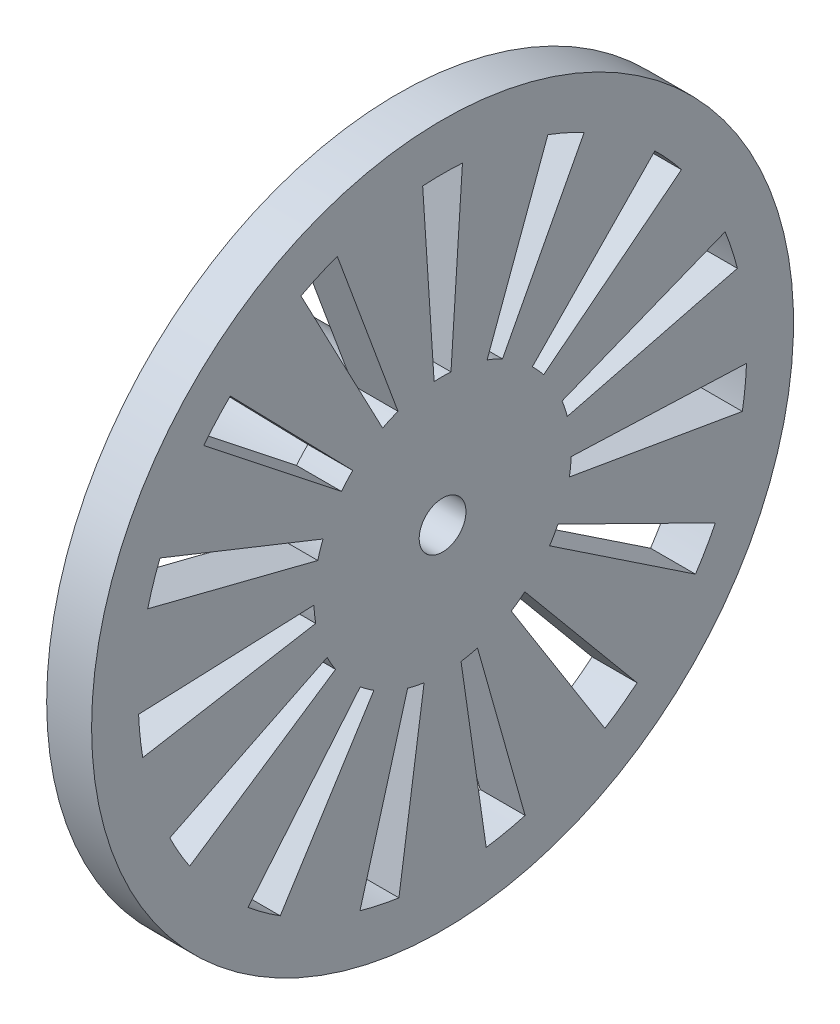
from build123d import *

# Parameters (mm, degrees)
CUT_EXTRUDE1_DEPTH = 12.506154875
CIRPATTERN1_COUNT  = 15


with BuildPart() as part:
    # Sketch1 → Revolve1 (revolve)
    with BuildSketch(Plane.XY, mode=Mode.PRIVATE) as revolve1_sk:
        Polygon((0, 0.5), (4.46, 0.5), (4.46, 7.5), (3.5, 7.5), (3.5, 1.75), (0, 1.75), align=None)
    revolve(revolve1_sk.sketch.rotate(Axis((-1851.483850706, 0, 0), (1, 0, 0)), 90), axis=Axis((-1851.483850706, 0, 0), (1, 0, 0)))

    # Sketch2 → Cut-Extrude1 (cut, through all)
    with BuildSketch(Plane(origin=(4.46, 0, 0), x_dir=(0, 0, -1), z_dir=(1, 0, 0))):
        with BuildLine():
            Line((-0.42512034, 6.486083001), (-0.179858605, 2.744112039))
            ThreePointArc((-0.179858605, 2.744112039), (0, 2.75), (0.179858605, 2.744112039))
            Line((0.179858605, 2.744112039), (0.42512034, 6.486083001))
            ThreePointArc((0.42512034, 6.486083001), (0, 6.5), (-0.42512034, 6.486083001))
        make_face()
    cut_extrude1 = extrude(amount=-CUT_EXTRUDE1_DEPTH, mode=Mode.SUBTRACT)

    # CirPattern1: Cut-Extrude1 ×15 about axis
    cirpattern1_axis = Axis((0, 0, 0), (1, 0, 0))
    for i in range(1, CIRPATTERN1_COUNT):
        add(cut_extrude1.rotate(cirpattern1_axis, i * 360 / CIRPATTERN1_COUNT), mode=Mode.SUBTRACT)


solid = part.part
